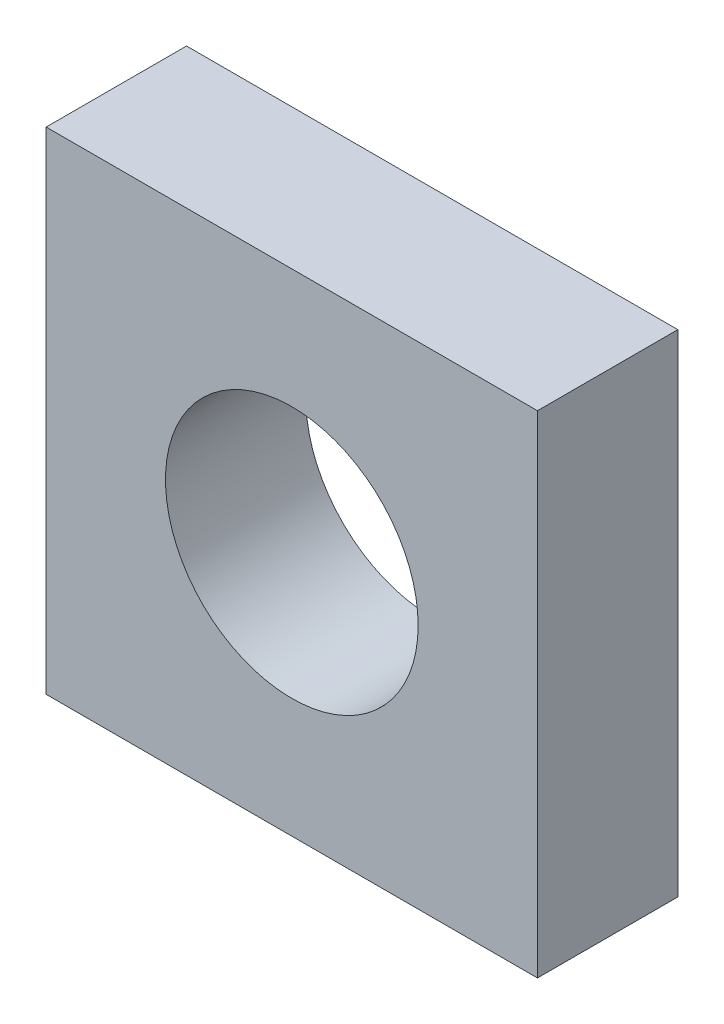
from build123d import *

# Parameters (mm, degrees)
ESQUISSE1_W        = 70
ESQUISSE1_H        = 70
ESQUISSE1_R        = 18
BOSS_EXTRU_1_DEPTH = 20


with BuildPart() as part:
    # Esquisse1 → Boss.-Extru.1 (new body)
    with BuildSketch(Plane.XY):
        Rectangle(ESQUISSE1_W, ESQUISSE1_H)
        Circle(ESQUISSE1_R, mode=Mode.SUBTRACT)
    extrude(amount=BOSS_EXTRU_1_DEPTH)


solid = part.part
